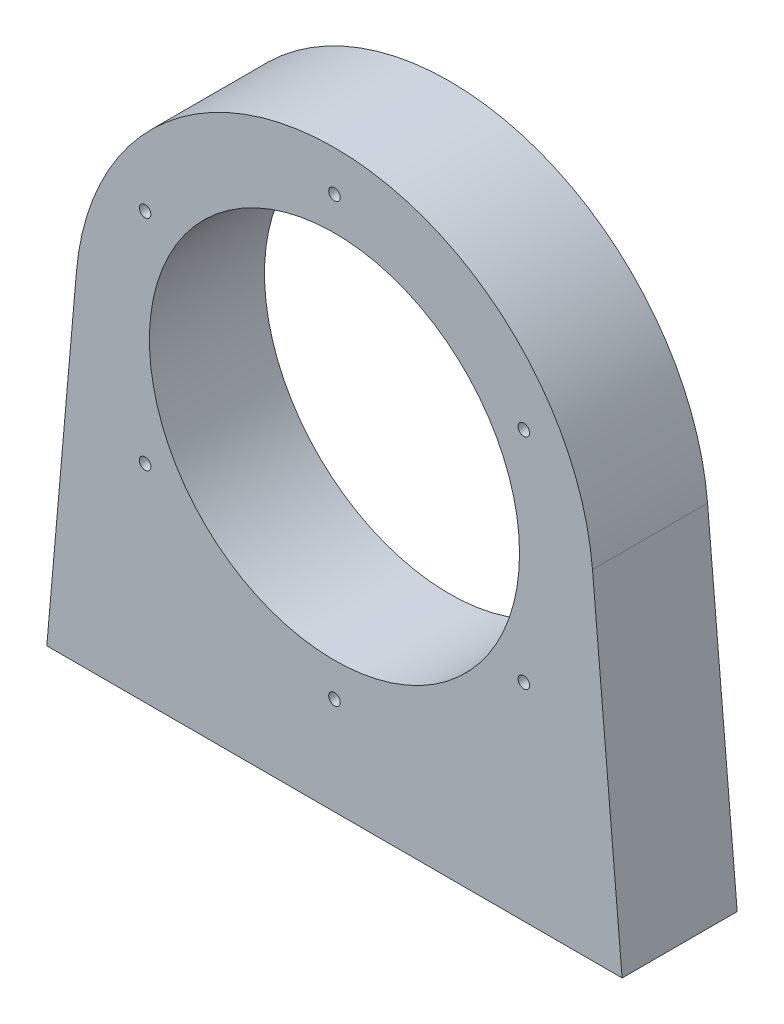
from build123d import *

# Parameters (mm, degrees)
EXTRUDE_1_DEPTH     = 30
CUT_EXTRUDE_1_REACH = 216.243
SKETCH_2_R          = 1.5


with BuildPart() as part:
    # 草图1 → 凸台-拉伸1 (new body)
    with BuildSketch(Plane.XY):
        with BuildLine():
            Line((7.726793577, 88.353296402), (0, 0))
            Line((0, 0), (75, 0))
            Line((75, 0), (75, 34.220027747))
            ThreePointArc((75, 34.220027747), (26.75, 82.470027747), (75, 130.720027747))
            Line((75, 130.720027747), (75, 150))
            ThreePointArc((75, 150), (29.376540117, 132.257546873), (7.726793577, 88.353296402))
        make_face()
        with BuildLine():
            Line((75, 34.220027747), (75, 0))
            Line((75, 0), (150, 0))
            Line((150, 0), (142.273206423, 88.353296402))
            ThreePointArc((142.273206423, 88.353296402), (120.623459883, 132.257546873), (75, 150))
            Line((75, 150), (75, 130.720027747))
            ThreePointArc((75, 130.720027747), (109.117902192, 116.587929939), (123.25, 82.470027747))
            ThreePointArc((123.25, 82.470027747), (109.117902192, 48.352125555), (75, 34.220027747))
        make_face()
    extrude(amount=EXTRUDE_1_DEPTH)

    # 草图2 → 切除-拉伸1 (cut, up to next)
    with BuildSketch(Plane.XY.offset(30), mode=Mode.PRIVATE) as cut_extrude_1_sk1:
        with Locations((75, 139.470027747)):
            Circle(SKETCH_2_R)
    cut_extrude_1_tool1 = extrude(cut_extrude_1_sk1.sketch, amount=-CUT_EXTRUDE_1_REACH, mode=Mode.PRIVATE) & part.part
    # 草图2 → 切除-拉伸1 (cut, up to next)
    with BuildSketch(Plane.XY.offset(30), mode=Mode.PRIVATE) as cut_extrude_1_sk2:
        with Locations((124.363448016, 110.970027747)):
            Circle(SKETCH_2_R)
    cut_extrude_1_tool2 = extrude(cut_extrude_1_sk2.sketch, amount=-CUT_EXTRUDE_1_REACH, mode=Mode.PRIVATE) & part.part
    # 草图2 → 切除-拉伸1 (cut, up to next)
    with BuildSketch(Plane.XY.offset(30), mode=Mode.PRIVATE) as cut_extrude_1_sk3:
        with Locations((124.363448016, 53.970027747)):
            Circle(SKETCH_2_R)
    cut_extrude_1_tool3 = extrude(cut_extrude_1_sk3.sketch, amount=-CUT_EXTRUDE_1_REACH, mode=Mode.PRIVATE) & part.part
    # 草图2 → 切除-拉伸1 (cut, up to next)
    with BuildSketch(Plane.XY.offset(30), mode=Mode.PRIVATE) as cut_extrude_1_sk4:
        with Locations((75, 25.470027747)):
            Circle(SKETCH_2_R)
    cut_extrude_1_tool4 = extrude(cut_extrude_1_sk4.sketch, amount=-CUT_EXTRUDE_1_REACH, mode=Mode.PRIVATE) & part.part
    # 草图2 → 切除-拉伸1 (cut, up to next)
    with BuildSketch(Plane.XY.offset(30), mode=Mode.PRIVATE) as cut_extrude_1_sk5:
        with Locations((25.636551984, 53.970027747)):
            Circle(SKETCH_2_R)
    cut_extrude_1_tool5 = extrude(cut_extrude_1_sk5.sketch, amount=-CUT_EXTRUDE_1_REACH, mode=Mode.PRIVATE) & part.part
    # 草图2 → 切除-拉伸1 (cut, up to next)
    with BuildSketch(Plane.XY.offset(30), mode=Mode.PRIVATE) as cut_extrude_1_sk6:
        with Locations((25.636551984, 110.970027747)):
            Circle(SKETCH_2_R)
    cut_extrude_1_tool6 = extrude(cut_extrude_1_sk6.sketch, amount=-CUT_EXTRUDE_1_REACH, mode=Mode.PRIVATE) & part.part
    add(cut_extrude_1_tool1.solids().sort_by_distance((75, 139.470028, 30))[0], mode=Mode.SUBTRACT)
    add(cut_extrude_1_tool2.solids().sort_by_distance((124.363448, 110.970028, 30))[0], mode=Mode.SUBTRACT)
    add(cut_extrude_1_tool3.solids().sort_by_distance((124.363448, 53.970028, 30))[0], mode=Mode.SUBTRACT)
    add(cut_extrude_1_tool4.solids().sort_by_distance((75, 25.470028, 30))[0], mode=Mode.SUBTRACT)
    add(cut_extrude_1_tool5.solids().sort_by_distance((25.636552, 53.970028, 30))[0], mode=Mode.SUBTRACT)
    add(cut_extrude_1_tool6.solids().sort_by_distance((25.636552, 110.970028, 30))[0], mode=Mode.SUBTRACT)


solid = part.part
